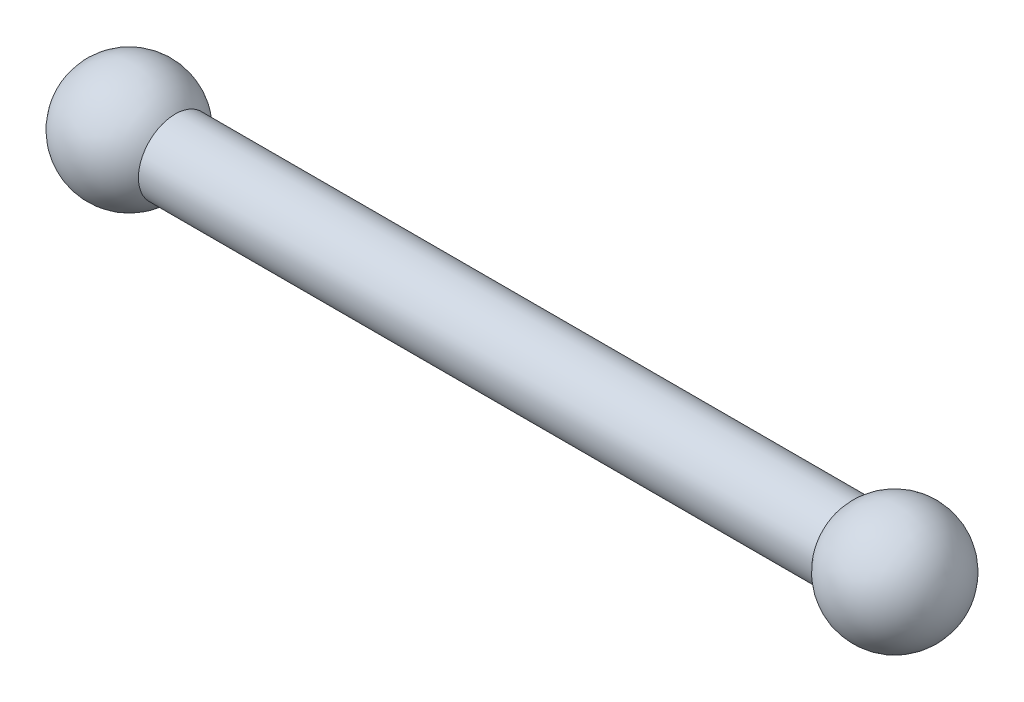
from build123d import *


with BuildPart() as part:
    # Sketch1 → Revolve1 (revolve)
    with BuildSketch(Plane.XY):
        with BuildLine():
            Line((0, 0), (0, 12.7))
            Line((0, 12.7), (116.217705084, 12.7))
            ThreePointArc((116.217705084, 12.7), (138.809805618, 19.173213511), (152.4, 0))
            Line((152.4, 0), (0, 0))
        make_face()
    revolve1 = revolve(axis=Axis((0, 0, 0), (1, 0, 0)))

    # Mirror1: Revolve1 across plane
    add(revolve1.mirror(Plane(origin=(0, 0, 0), x_dir=(0, 0, 1), z_dir=(1, 0, 0))))


solid = part.part
